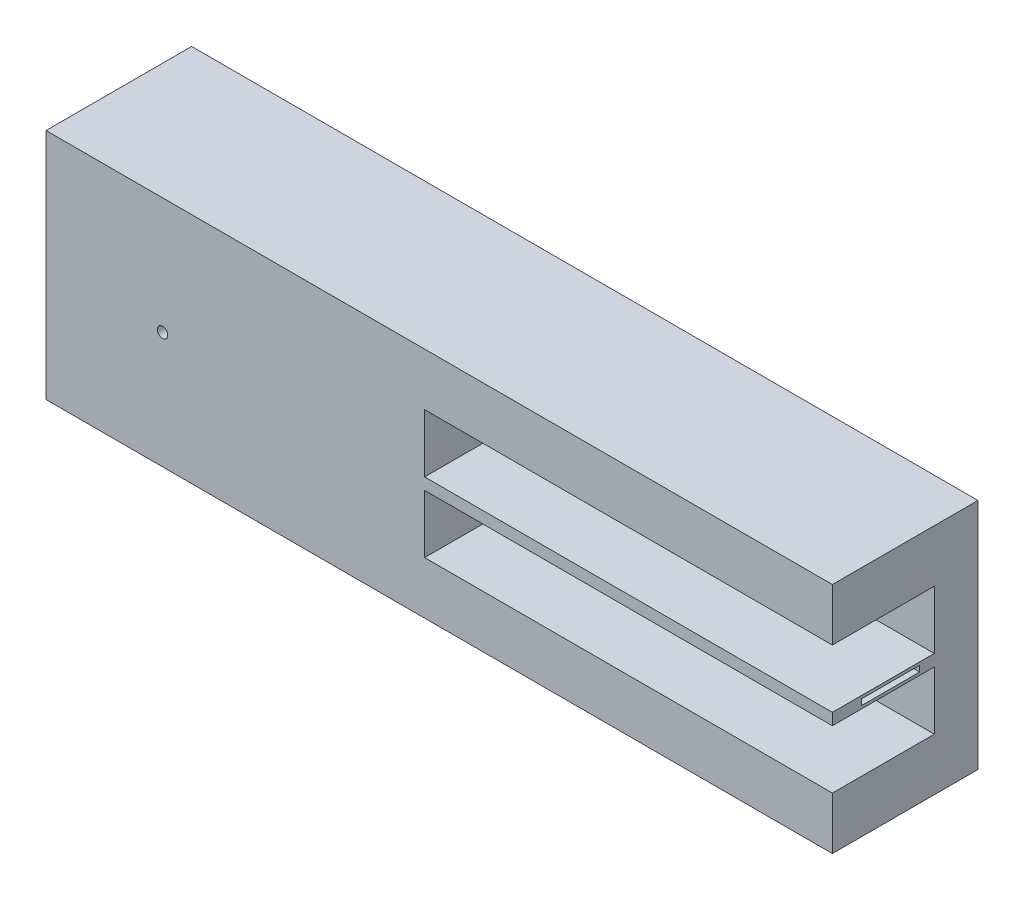
from build123d import *

# Parameters (mm, degrees)
ELEC_CH_SKETCH_W         = 0.2
ELEC_CH_SKETCH_H         = 2
SKETCH2_R                = 0.18
BOSS_EXTRUDE1_DEPTH      = 19
BOSS_EXTRUDE1_DEPTH_BACK = 8
SKETCH3_W                = 5
SKETCH3_H                = 8
SKETCH5_W                = 14
SKETCH5_H                = 2
CUT_EXTRUDE1_DEPTH       = 3.5


with BuildPart() as part:
    # Sweep2: sweep along a path in guide
    with BuildLine(Plane(origin=(0, 0, 0), x_dir=(-1, 0, 0), z_dir=(0, 1, 0))) as sweep2_path:
        Line((0, 0), (-15, 0))
    # elec_ch_sketch → Sweep2 (sweep)
    with BuildSketch(Plane.YZ):
        Rectangle(ELEC_CH_SKETCH_W, ELEC_CH_SKETCH_H)
    sweep(path=sweep2_path.line)



with BuildPart() as body_2:
    # Sweep3: sweep along a path in guide<3>
    with BuildLine(Plane(origin=(0, 0, 0), x_dir=(-1, 0, 0), z_dir=(0, 1, 0))) as sweep3_path:
        Line((4, 0), (6, 0))
        ThreePointArc((6, 0), (7.414213562, 0.585786438), (8, 2))
    # Sketch2 → Sweep3 (sweep)
    with BuildSketch(Plane(origin=(-4, 0, 0), x_dir=(0, 0, -1), z_dir=(1, 0, 0))):
        Circle(SKETCH2_R)
    sweep(path=sweep3_path.line)


with BuildPart() as part_1:
    add(part.part)

    add(body_2.part)  # Loft1 merges body 2
    # Sketch2<3> for Loft1 → Loft1 section 0
    with BuildSketch(Plane(origin=(-4, 0, 0), x_dir=(0, 0, -1), z_dir=(1, 0, 0))):
        with BuildLine():
            # circular arc as an exact rational Bezier (weights 1, cos(half-angle), 1)
            Bezier((0.179106694, -0.017910669), (0.180897761, 0), (0.179106694, 0.017910669), weights=[1, 0.995037187, 1])
            Bezier((0.179106694, 0.017910669), (0, 1.80897768), (-0.179106694, 0.017910669), weights=[1, 0.099503715, 1])
            Bezier((-0.179106694, 0.017910669), (-0.180897761, 0), (-0.179106694, -0.017910669), weights=[1, 0.995037187, 1])
            Bezier((-0.179106694, -0.017910669), (0, -1.80897768), (0.179106694, -0.017910669), weights=[1, 0.099503715, 1])
        make_face()
    # elec_ch_sketch<3> → Loft1 section 1
    with BuildSketch(Plane.YZ):
        with BuildLine():
            Line((-0.1, -1), (0.1, -1))
            Line((0.1, -1), (0.1, 1))
            Line((0.1, 1), (-0.1, 1))
            Line((-0.1, 1), (-0.1, -1))
        make_face()
    loft()


with BuildPart() as body_2_2:
    # Sketch3 → Boss-Extrude1 (new, two sides: drawn at the far end of the back side and taken through both)
    with BuildSketch(Plane(origin=(-4, 0, 0), x_dir=(0, 0, -1), z_dir=(1, 0, 0)).offset(-BOSS_EXTRUDE1_DEPTH_BACK)):
        with Locations((0.5, 0)):
            Rectangle(SKETCH3_W, SKETCH3_H)
    extrude(amount=BOSS_EXTRUDE1_DEPTH + BOSS_EXTRUDE1_DEPTH_BACK)

    # Combine1: cut part
    add(part_1.part, mode=Mode.SUBTRACT)

    # Sketch5 → Cut-Extrude1 (cut)
    with BuildSketch(Plane.XY.offset(2)):
        with Locations((8, -1.2)):
            Rectangle(SKETCH5_W, SKETCH5_H)
        with Locations((8, 1.2)):
            Rectangle(SKETCH5_W, SKETCH5_H)
    extrude(amount=-CUT_EXTRUDE1_DEPTH, mode=Mode.SUBTRACT)


solid = body_2_2.part
